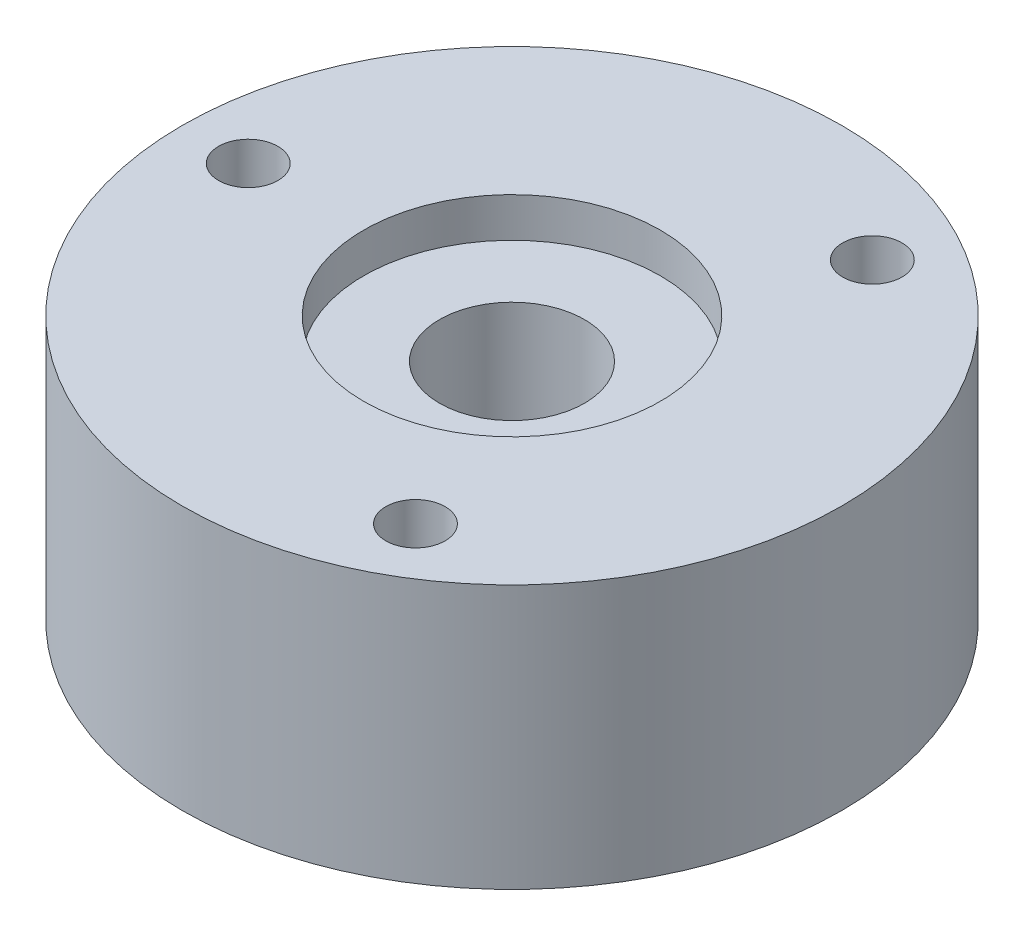
from build123d import *

# Parameters (mm, degrees)
SKETCH1_R           = 25
SKETCH1_R_2         = 5.5
BOSS_EXTRUDE1_DEPTH = 20
SKETCH2_R           = 11.25
CUT_EXTRUDE2_DEPTH  = 3
SKETCH3_R           = 2.25
CUT_EXTRUDE3_DEPTH  = 20
CIRPATTERN1_COUNT   = 3


with BuildPart() as part:
    # Sketch1 → Boss-Extrude1 (new body)
    with BuildSketch(Plane(origin=(0, 0, 0), x_dir=(1, 0, 0), z_dir=(0, 1, 0))):
        with Locations(Location((0, 0, 0), (0, 0, 270))):
            Circle(SKETCH1_R)
        with Locations(Location((0, 0, 0), (0, 0, 270))):
            Circle(SKETCH1_R_2, mode=Mode.SUBTRACT)
    extrude(amount=BOSS_EXTRUDE1_DEPTH)

    # Sketch2 → Cut-Extrude2 (cut)
    with BuildSketch(Plane(origin=(0, 20, 0), x_dir=(1, 0, 0), z_dir=(0, 1, 0))):
        with Locations(Location((0, 0, 0), (0, 0, 270))):
            Circle(SKETCH2_R)
    extrude(amount=-CUT_EXTRUDE2_DEPTH, mode=Mode.SUBTRACT)

    # Sketch3 → Cut-Extrude3 (cut)
    with BuildSketch(Plane(origin=(0, 20, 0), x_dir=(1, 0, 0), z_dir=(0, 1, 0))):
        with Locations(Location((10, -17.320508076, 0), (0, 0, 270))):
            Circle(SKETCH3_R)
    cut_extrude3 = extrude(amount=-CUT_EXTRUDE3_DEPTH, mode=Mode.SUBTRACT)

    # CirPattern1: Cut-Extrude3 ×3 about axis
    cirpattern1_axis = Axis((0, 0, 0), (0, 1, 0))
    for i in range(1, CIRPATTERN1_COUNT):
        add(cut_extrude3.rotate(cirpattern1_axis, i * 360 / CIRPATTERN1_COUNT), mode=Mode.SUBTRACT)


solid = part.part
